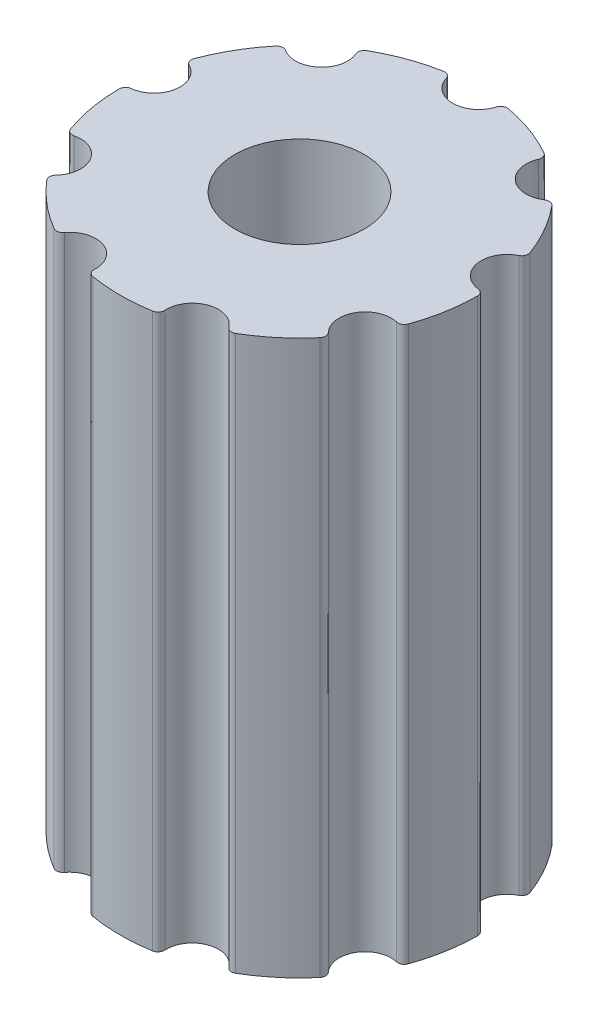
from build123d import *

# Parameters (mm, degrees)
SKETCH1_R           = 1.985
BOSS_EXTRUDE1_DEPTH = 17


with BuildPart() as part:
    # Sketch1 → Boss-Extrude1 (new body)
    with BuildSketch(Plane(origin=(0, 0, 0), x_dir=(1, 0, 0), z_dir=(0, 1, 0))):
        with BuildLine():
            ThreePointArc((-0.993994068, 5.409433962), (-1.881110788, 5.168309414), (-2.715673494, 4.782793898))
            ThreePointArc((-2.715673494, 4.782793898), (-2.806527228, 4.672511809), (-2.800603755, 4.529748184))
            ThreePointArc((-2.800603755, 4.529748184), (-3.021101766, 3.600408883), (-3.974611392, 3.544638808))
            ThreePointArc((-3.974611392, 3.544638808), (-4.114177517, 3.575262934), (-4.238560759, 3.504939756))
            ThreePointArc((-4.238560759, 3.504939756), (-4.763139721, 2.75), (-5.154647247, 1.918231415))
            ThreePointArc((-5.154647247, 1.918231415), (-5.153357284, 1.775350778), (-5.057052951, 1.669795032))
            ThreePointArc((-5.057052951, 1.669795032), (-4.628596439, 0.816146435), (-5.323178877, 0.160519906))
            ThreePointArc((-5.323178877, 0.160519906), (-5.44977754, 0.094267971), (-5.499857764, -0.039554715))
            ThreePointArc((-5.499857764, -0.039554715), (-5.416442642, -0.955064977), (-5.181704266, -1.843892867))
            ThreePointArc((-5.181704266, -1.843892867), (-5.088874194, -1.952516612), (-4.947250869, -1.971473774))
            ThreePointArc((-4.947250869, -1.971473774), (-4.070319398, -2.35), (-4.180971805, -3.298708045))
            ThreePointArc((-4.180971805, -3.298708045), (-4.235366084, -3.430836023), (-4.187710197, -3.565541096))
            ThreePointArc((-4.187710197, -3.565541096), (-3.535331853, -4.213244437), (-2.78418427, -4.743239183))
            ThreePointArc((-2.78418427, -4.743239183), (-2.643250312, -4.76677978), (-2.522575122, -4.69026809))
            ThreePointArc((-2.522575122, -4.69026809), (-1.607494674, -4.416555318), (-1.082441559, -5.21443384))
            ThreePointArc((-1.082441559, -5.21443384), (-1.039179767, -5.350613712), (-0.916086488, -5.423171171))
            ThreePointArc((-0.916086488, -5.423171171), (0, -5.5), (0.916086488, -5.423171171))
            ThreePointArc((0.916086488, -5.423171171), (1.039179767, -5.350613712), (1.082441559, -5.21443384))
            ThreePointArc((1.082441559, -5.21443384), (1.607494674, -4.416555318), (2.522575122, -4.69026809))
            ThreePointArc((2.522575122, -4.69026809), (2.643250312, -4.76677978), (2.78418427, -4.743239183))
            ThreePointArc((2.78418427, -4.743239183), (3.535331853, -4.213244437), (4.187710197, -3.565541096))
            ThreePointArc((4.187710197, -3.565541096), (4.235366084, -3.430836023), (4.180971805, -3.298708045))
            ThreePointArc((4.180971805, -3.298708045), (4.070319398, -2.35), (4.947250869, -1.971473774))
            ThreePointArc((4.947250869, -1.971473774), (5.088874194, -1.952516612), (5.181704266, -1.843892867))
            ThreePointArc((5.181704266, -1.843892867), (5.416442642, -0.955064977), (5.499857764, -0.039554715))
            ThreePointArc((5.499857764, -0.039554715), (5.44977754, 0.094267971), (5.323178877, 0.160519906))
            ThreePointArc((5.323178877, 0.160519906), (4.628596439, 0.816146435), (5.057052951, 1.669795032))
            ThreePointArc((5.057052951, 1.669795032), (5.153357284, 1.775350778), (5.154647247, 1.918231415))
            ThreePointArc((5.154647247, 1.918231415), (4.763139721, 2.75), (4.238560759, 3.504939756))
            ThreePointArc((4.238560759, 3.504939756), (4.114177517, 3.575262934), (3.974611392, 3.544638808))
            ThreePointArc((3.974611392, 3.544638808), (3.021101766, 3.600408883), (2.800603755, 4.529748184))
            ThreePointArc((2.800603755, 4.529748184), (2.806527228, 4.672511809), (2.715673494, 4.782793898))
            ThreePointArc((2.715673494, 4.782793898), (1.881110788, 5.168309414), (0.993994068, 5.409433962))
            ThreePointArc((0.993994068, 5.409433962), (0.85350811, 5.383352635), (0.766279064, 5.270181818))
            ThreePointArc((0.766279064, 5.270181818), (0, 4.7), (-0.766279064, 5.270181818))
            ThreePointArc((-0.766279064, 5.270181818), (-0.85350811, 5.383352635), (-0.993994068, 5.409433962))
        make_face()
        with Locations(Location((0, 0, 0), (0, 0, 270))):
            Circle(SKETCH1_R, mode=Mode.SUBTRACT)
    extrude(amount=BOSS_EXTRUDE1_DEPTH)


solid = part.part
